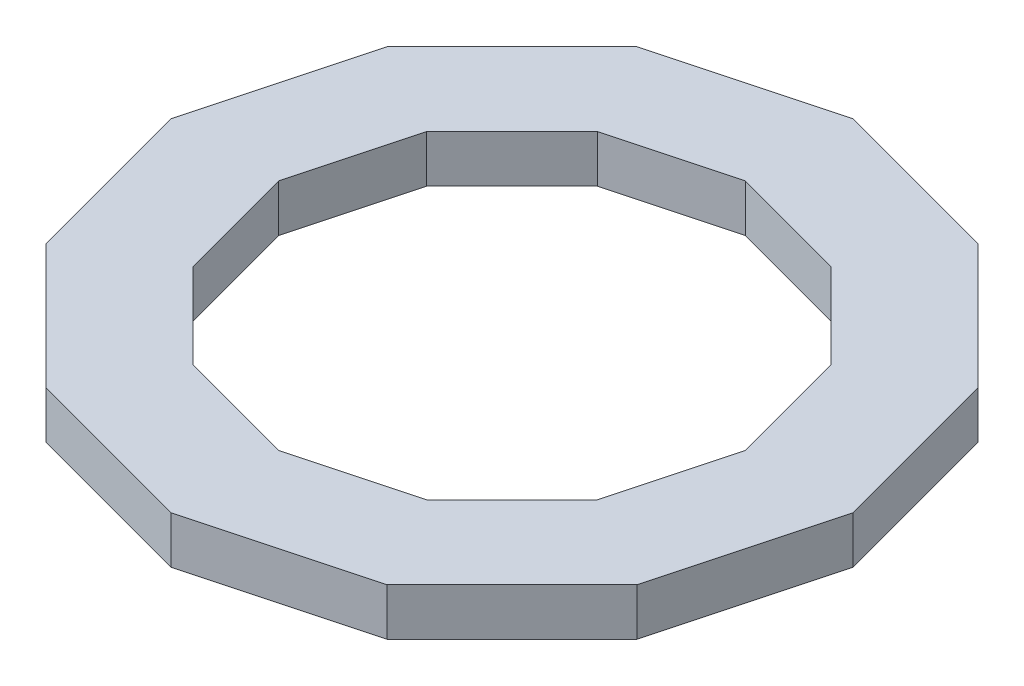
from build123d import *

# Parameters (mm, degrees)
BOSS_EXTRUDE2_DEPTH = 19.05


with BuildPart() as part:
    # Sketch2 → Boss-Extrude2 (new body)
    with BuildSketch(Plane(origin=(0, 0, 0), x_dir=(1, 0, 0), z_dir=(0, 1, 0))):
        Polygon((-137.393289531, 0), (-118.986079044, -68.696644766), (-68.696644766, -118.986079044), (0, -137.393289531), (68.696644766, -118.986079044), (118.986079044, -68.696644766), (137.393289531, 0), (118.986079044, 68.696644766), (68.696644766, 118.986079044), (0, 137.393289531), (-68.696644766, 118.986079044), (-118.986079044, 68.696644766), align=None)
        Polygon((-94.00486481, 0), (-81.410601005, -47.002432405), (-47.002432405, -81.410601005), (0, -94.00486481), (47.002432405, -81.410601005), (81.410601005, -47.002432405), (94.00486481, 0), (81.410601005, 47.002432405), (47.002432405, 81.410601005), (0, 94.00486481), (-47.002432405, 81.410601005), (-81.410601005, 47.002432405), align=None, mode=Mode.SUBTRACT)
    extrude(amount=BOSS_EXTRUDE2_DEPTH)


solid = part.part
